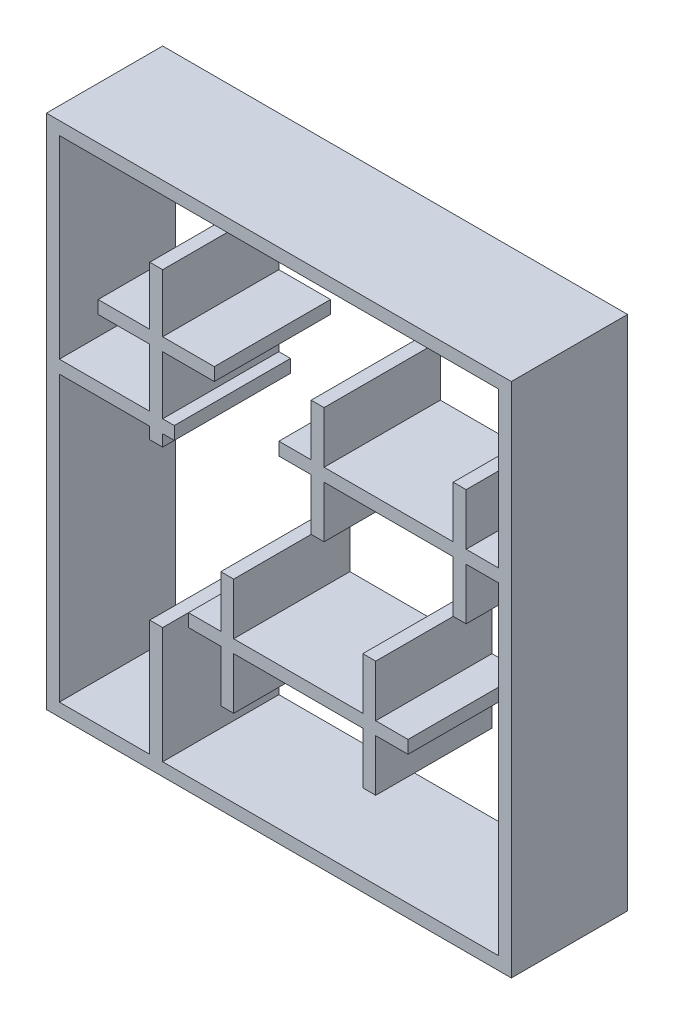
from build123d import *

# Parameters (mm, degrees)
SKETCH1_W           = 180
SKETCH1_H           = 200
SKETCH1_W_2         = 170
SKETCH1_H_2         = 190
SKETCH1_W_3         = 35
SKETCH1_H_3         = 5
SKETCH1_W_4         = 5
SKETCH1_H_4         = 22.5
SKETCH1_W_5         = 20
SKETCH1_H_5         = 4.5
SKETCH1_W_6         = 4.5
SKETCH1_H_6         = 45
BOSS_EXTRUDE1_DEPTH = 45
SCALE1_SCALE        = 10


with BuildPart() as part:
    # Sketch1 → Boss-Extrude1 (new body)
    # profile 1 of 13: a face of its own
    with BuildSketch(Plane.XY):
        Rectangle(SKETCH1_W, SKETCH1_H)
        Rectangle(SKETCH1_W_2, SKETCH1_H_2, mode=Mode.SUBTRACT)
    # profile 2 of 13: a face of its own
    with BuildSketch(Plane.XY):
        with Locations((-67.5, 17.5)):
            Rectangle(SKETCH1_W_3, SKETCH1_H_3)
    # profile 3 of 13: a face of its own
    with BuildSketch(Plane.XY):
        with Locations((-47.5, 31.25)):
            Rectangle(SKETCH1_W_4, SKETCH1_H_4)
    # profile 4 of 13: a face of its own
    with BuildSketch(Plane.XY):
        with Locations((-60, 45)):
            Rectangle(SKETCH1_W_5, SKETCH1_H_3)
    # profile 5 of 13: a face of its own
    with BuildSketch(Plane.XY):
        with Locations((-47.5, 45)):
            Rectangle(SKETCH1_W_4, SKETCH1_H_3)
    # profile 6 of 13: a face of its own
    with BuildSketch(Plane.XY):
        with Locations((-47.5, 58.75)):
            Rectangle(SKETCH1_W_4, SKETCH1_H_4)
    # profile 7 of 13: a face of its own
    with BuildSketch(Plane.XY):
        with Locations((-35, 45)):
            Rectangle(SKETCH1_W_5, SKETCH1_H_3)
    # profile 8 of 13: a face of its own
    with BuildSketch(Plane.XY):
        with Locations((-47.5, 17.5)):
            Rectangle(SKETCH1_W_4, SKETCH1_H_3)
    # profile 9 of 13: a face of its own
    with BuildSketch(Plane.XY):
        with Locations((-47.5, 12.75)):
            Rectangle(SKETCH1_W_4, SKETCH1_H_5)
    # profile 10 of 13: a face of its own
    with BuildSketch(Plane.XY):
        with Locations((-42.75, 17.5)):
            Rectangle(SKETCH1_W_6, SKETCH1_H_3)
    # profile 11 of 13: a face of its own
    with BuildSketch(Plane.XY):
        Polygon((72.5, 30), (85, 30), (85, 35), (72.5, 35), (72.5, 55), (67.5, 55), (67.5, 35), (17.5, 35), (17.5, 55), (12.5, 55), (12.5, 35), (0, 35), (0, 30), (12.5, 30), (12.5, 10), (17.5, 10), (17.5, 30), (67.5, 30), (67.5, 10), (72.5, 10), align=None)
    # profile 12 of 13: a face of its own
    with BuildSketch(Plane.XY):
        with Locations((-47.5, -72.5)):
            Rectangle(SKETCH1_W_4, SKETCH1_H_6)
    # profile 13 of 13: a face of its own
    with BuildSketch(Plane.XY):
        Polygon((32.5, -40), (32.5, -20), (37.5, -20), (37.5, -40), (50, -40), (50, -45), (37.5, -45), (37.5, -65), (32.5, -65), (32.5, -45), (-17.5, -45), (-17.5, -65), (-22.5, -65), (-22.5, -45), (-35, -45), (-35, -40), (-22.5, -40), (-22.5, -20), (-17.5, -20), (-17.5, -40), align=None)
    extrude(amount=BOSS_EXTRUDE1_DEPTH)


with BuildPart() as part_1:
    # Scale1: scaled about (0, 0, 0)
    add(part.part.scale(SCALE1_SCALE))


solid = part_1.part
